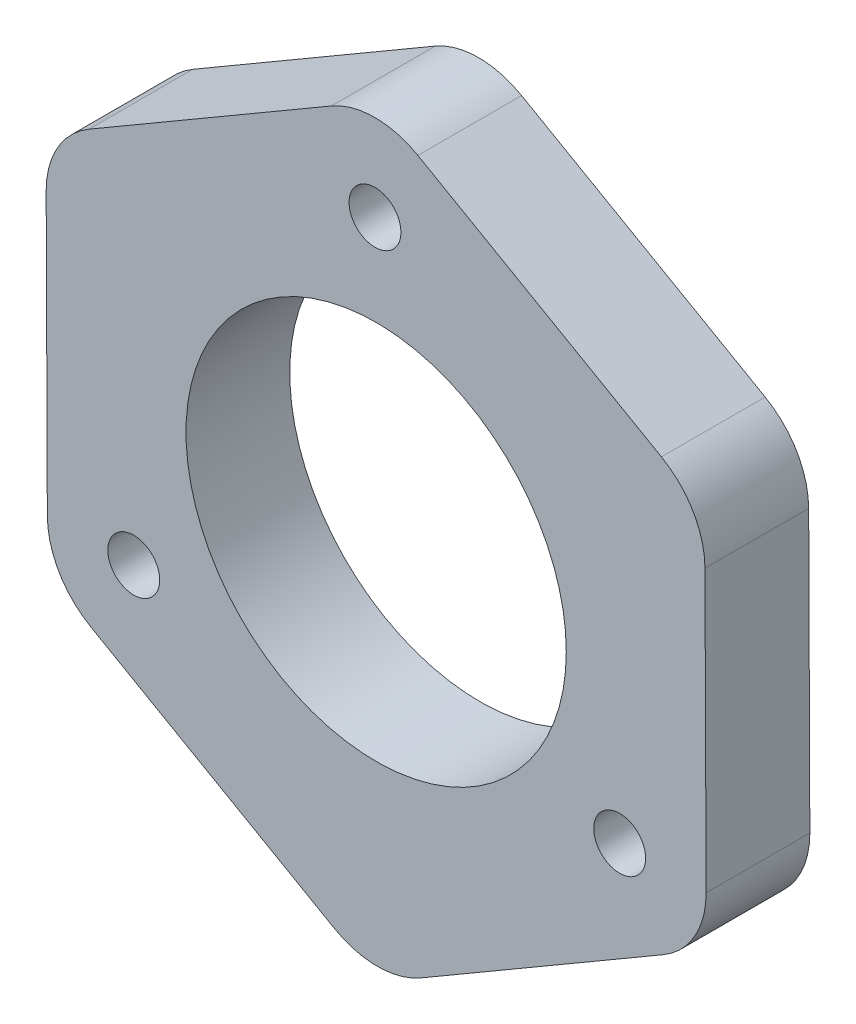
from build123d import *

# Parameters (mm, degrees)
SKETCH1_R           = 1.5
SKETCH1_R_2         = 11
BOSS_EXTRUDE1_DEPTH = 6


with BuildPart() as part:
    # Sketch1 → Boss-Extrude1 (new body)
    with BuildSketch(Plane.XY):
        with BuildLine():
            Line((-151.61, 255.99), (-137.588248756, 264.163334206))
            ThreePointArc((-137.588248756, 264.163334206), (-135.765350109, 266.001445333), (-135.105729136, 268.504745587))
            Line((-135.105729136, 268.504745587), (-135.17316857, 284.734605473))
            ThreePointArc((-135.17316857, 284.734605473), (-135.853571223, 287.232339366), (-137.691684909, 289.05523828))
            Line((-137.691684909, 289.05523828), (-151.780882276, 297.111752263))
            ThreePointArc((-151.780882276, 297.111752263), (-154.284183023, 297.771371919), (-156.781915286, 297.090970369))
            Line((-156.781915286, 297.090970369), (-170.803669208, 288.917640758))
            ThreePointArc((-170.803669208, 288.917640758), (-172.626568236, 287.079529849), (-173.286188827, 284.576229377))
            Line((-173.286188827, 284.576229377), (-173.218744076, 268.346369513))
            ThreePointArc((-173.218744076, 268.346369513), (-172.53834165, 265.848637636), (-170.700229926, 264.025739592))
            Line((-170.700229926, 264.025739592), (-156.611036608, 255.969218528))
            ThreePointArc((-156.611036608, 255.969218528), (-154.107734115, 255.309597623), (-151.61, 255.99))
        make_face()
        with Locations((-140.10676149, 268.483964952)):
            Circle(SKETCH1_R, mode=Mode.SUBTRACT)
        with Locations((-154.263401108, 292.770333894)):
            Circle(SKETCH1_R, mode=Mode.SUBTRACT)
        with Locations((-168.217711729, 268.367151786)):
            Circle(SKETCH1_R, mode=Mode.SUBTRACT)
        with Locations((-154.195957665, 276.540490609)):
            Circle(SKETCH1_R_2, mode=Mode.SUBTRACT)
    extrude(amount=BOSS_EXTRUDE1_DEPTH)


solid = part.part
